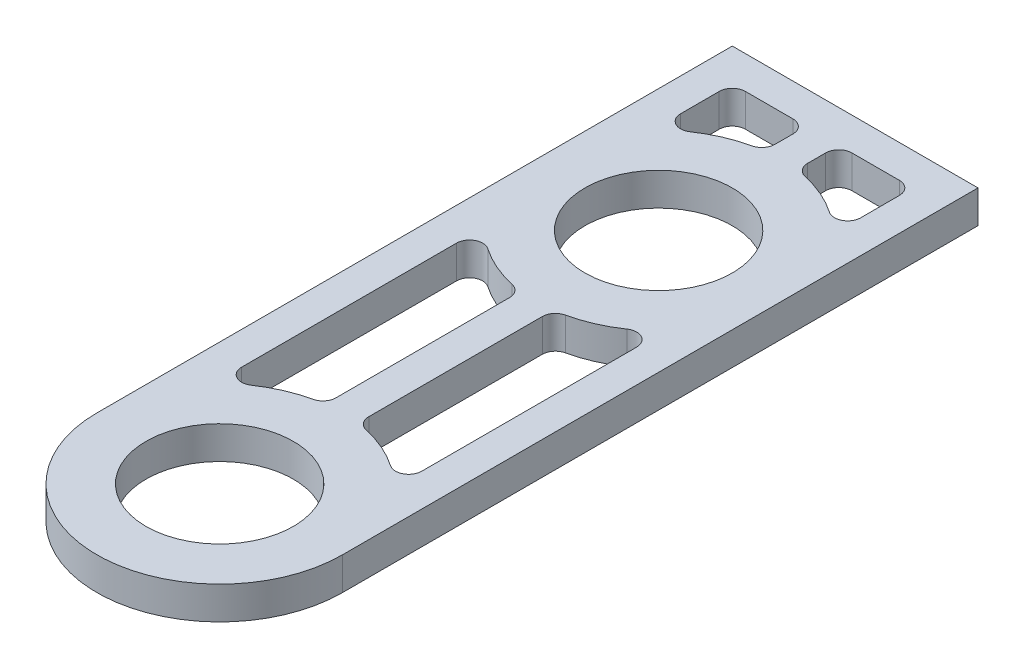
from build123d import *

# Parameters (mm, degrees)
SKETCH1_W           = 47.625
SKETCH1_H           = 152.4
SKETCH1_R           = 14.2875
BOSS_EXTRUDE1_DEPTH = 6.35
CUT_EXTRUDE1_DEPTH  = 81.086188923
FILLET1_R           = 2.54


with BuildPart() as part:
    # Sketch1 → Boss-Extrude1 (new body)
    with BuildSketch(Plane(origin=(0, 0, 0), x_dir=(1, 0, 0), z_dir=(0, 1, 0))):
        Rectangle(SKETCH1_W, SKETCH1_H)
        with Locations(Location((0, 38.1, 0), (0, 0, 270))):
            Circle(SKETCH1_R, mode=Mode.SUBTRACT)
        with Locations(Location((0, -46.99, 0), (0, 0, 270))):
            Circle(SKETCH1_R, mode=Mode.SUBTRACT)
    extrude(amount=BOSS_EXTRUDE1_DEPTH)

    # Sketch2 → Cut-Extrude1 (cut, through all)
    with BuildSketch(Plane(origin=(0, 6.35, 0), x_dir=(1, 0, 0), z_dir=(0, 1, 0))):
        with BuildLine():
            ThreePointArc((23.8125, -46.99), (0, -70.8025), (-23.8125, -46.99))
            Line((-23.8125, -46.99), (-23.8125, -76.2))
            Line((-23.8125, -76.2), (23.8125, -76.2))
            Line((23.8125, -76.2), (23.8125, -46.99))
        make_face()
        with BuildLine():
            Line((-17.4625, 69.85), (-17.4625, 54.289386956))
            ThreePointArc((-17.4625, 54.289386956), (-10.963825458, 59.238346377), (-3.175, 61.699884136))
            Line((-3.175, 61.699884136), (-3.175, 69.85))
            Line((-3.175, 69.85), (-17.4625, 69.85))
        make_face()
        with BuildLine():
            ThreePointArc((-3.175, 14.500115864), (-10.963825458, 16.961653623), (-17.4625, 21.910613044))
            Line((-17.4625, 21.910613044), (-17.4625, -30.800613044))
            ThreePointArc((-17.4625, -30.800613044), (-10.963825458, -25.851653623), (-3.175, -23.390115864))
            Line((-3.175, -23.390115864), (-3.175, 14.500115864))
        make_face()
        with BuildLine():
            ThreePointArc((3.175, 61.699884136), (10.963825458, 59.238346377), (17.4625, 54.289386956))
            Line((17.4625, 54.289386956), (17.4625, 69.85))
            Line((17.4625, 69.85), (3.175, 69.85))
            Line((3.175, 69.85), (3.175, 61.699884136))
        make_face()
        with BuildLine():
            Line((17.4625, -30.800613044), (17.4625, 21.910613044))
            ThreePointArc((17.4625, 21.910613044), (10.963825458, 16.961653623), (3.175, 14.500115864))
            Line((3.175, 14.500115864), (3.175, -23.390115864))
            ThreePointArc((3.175, -23.390115864), (10.963825458, -25.851653623), (17.4625, -30.800613044))
        make_face()
    extrude(amount=-CUT_EXTRUDE1_DEPTH, mode=Mode.SUBTRACT)

    # Fillet1
    fillet1_edges = [part.edges().sort_by_distance(p)[0] for p in [
        (17.4625, 3.175, 30.800613044),
        (3.175, 3.175, 23.390115864),
        (3.175, 3.175, -14.500115864),
        (17.4625, 3.175, -21.910613044),
        (-3.175, 3.175, 23.390115864),
        (-17.4625, 3.175, 30.800613044),
        (-17.4625, 3.175, -21.910613044),
        (-3.175, 3.175, -14.500115864),
        (-3.175, 3.175, -61.699884136),
        (-17.4625, 3.175, -54.289386956),
        (-17.4625, 3.175, -69.85),
        (-3.175, 3.175, -69.85),
        (17.4625, 3.175, -54.289386956),
        (3.175, 3.175, -61.699884136),
        (3.175, 3.175, -69.85),
        (17.4625, 3.175, -69.85),
    ]]
    fillet(fillet1_edges, radius=FILLET1_R)


solid = part.part
